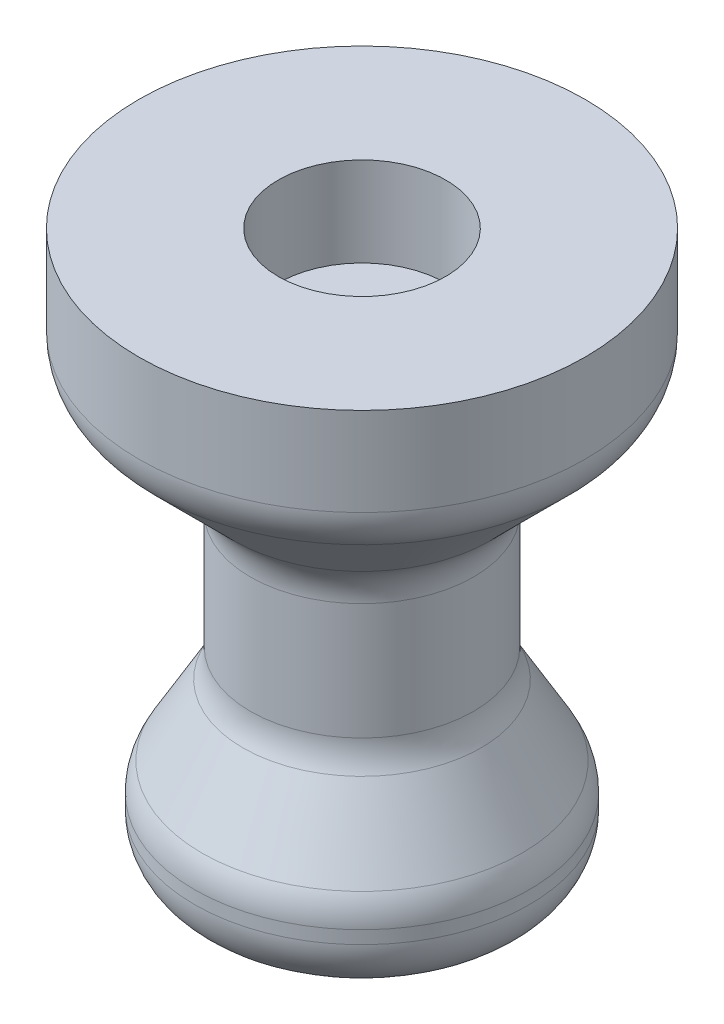
from build123d import *

# Parameters (mm, degrees)
FILLET1_R          = 2
SKETCH2_R          = 3
CUT_EXTRUDE1_DEPTH = 3.2


with BuildPart() as part:
    # Sketch1 → Revolve1 (revolve)
    with BuildSketch(Plane.XY, mode=Mode.PRIVATE) as revolve1_sk:
        Polygon((0, 0), (8, 0), (8, -4), (4, -8), (4, -13.535898385), (6, -17), (6, -20), (0, -20), align=None)
    revolve(revolve1_sk.sketch.rotate(Axis((0, 48.586008243, 0), (0, -1, 0)), 90), axis=Axis((0, 48.586008243, 0), (0, -1, 0)))

    # Fillet1
    fillet1_edges = [part.edges().sort_by_distance(p)[0] for p in [
        (0, -20, -6),
        (0, -17, -6),
        (0, -13.535898385, -4),
        (0, -8, -4),
        (0, -4, -8),
    ]]
    fillet(fillet1_edges, radius=FILLET1_R)

    # Sketch2 → Cut-Extrude1 (cut)
    with BuildSketch(Plane(origin=(0, 0, 0), x_dir=(1, 0, 0), z_dir=(0, 1, 0))):
        with Locations(Location((0, 0, 0), (0, 0, 270))):
            Circle(SKETCH2_R)
    extrude(amount=-CUT_EXTRUDE1_DEPTH, mode=Mode.SUBTRACT)


solid = part.part
